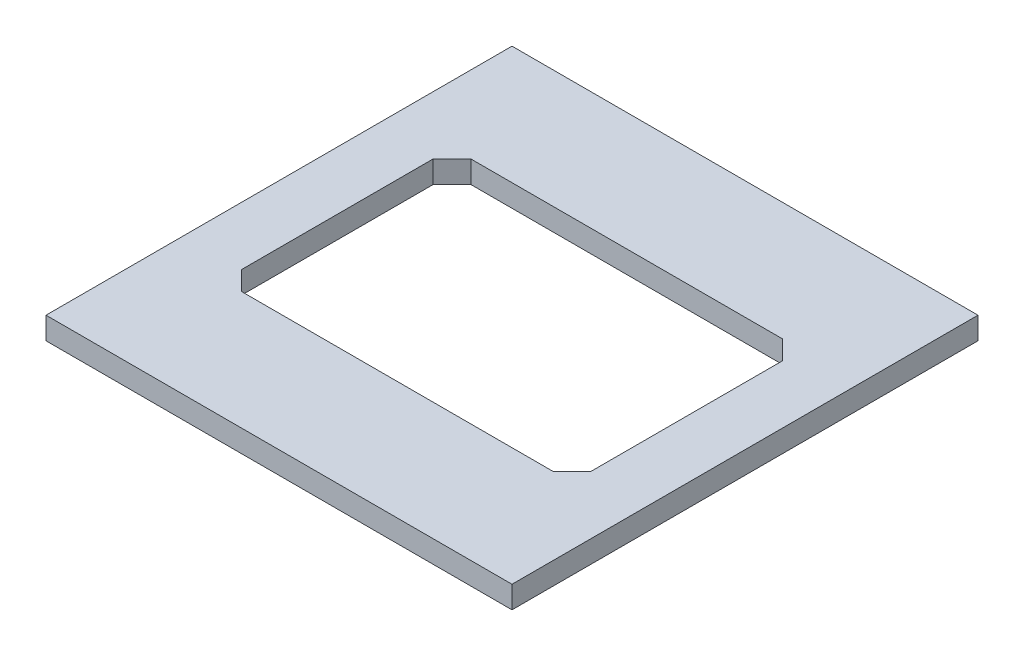
from build123d import *

# Parameters (mm, degrees)
SKETCH1_W           = 400
SKETCH1_H           = 400
BOSS_EXTRUDE1_DEPTH = 19.05
CUT_EXTRUDE1_DEPTH  = 284.48351363


with BuildPart() as part:
    # Sketch1 → Boss-Extrude1 (new body)
    with BuildSketch(Plane(origin=(0, 0, 0), x_dir=(1, 0, 0), z_dir=(0, 1, 0))):
        Rectangle(SKETCH1_W, SKETCH1_H)
    extrude(amount=BOSS_EXTRUDE1_DEPTH)

    # Sketch2 → Cut-Extrude1 (cut, through all)
    with BuildSketch(Plane(origin=(0, 19.05, 0), x_dir=(1, 0, 0), z_dir=(0, 1, 0))):
        Polygon((-150, -82.236544033), (-150, 82.236544033), (-133.736544033, 98.5), (133.736544033, 98.5), (150, 82.236544033), (150, -82.236544033), (133.736544033, -98.5), (-133.736544033, -98.5), align=None)
    extrude(amount=-CUT_EXTRUDE1_DEPTH, mode=Mode.SUBTRACT)


solid = part.part
